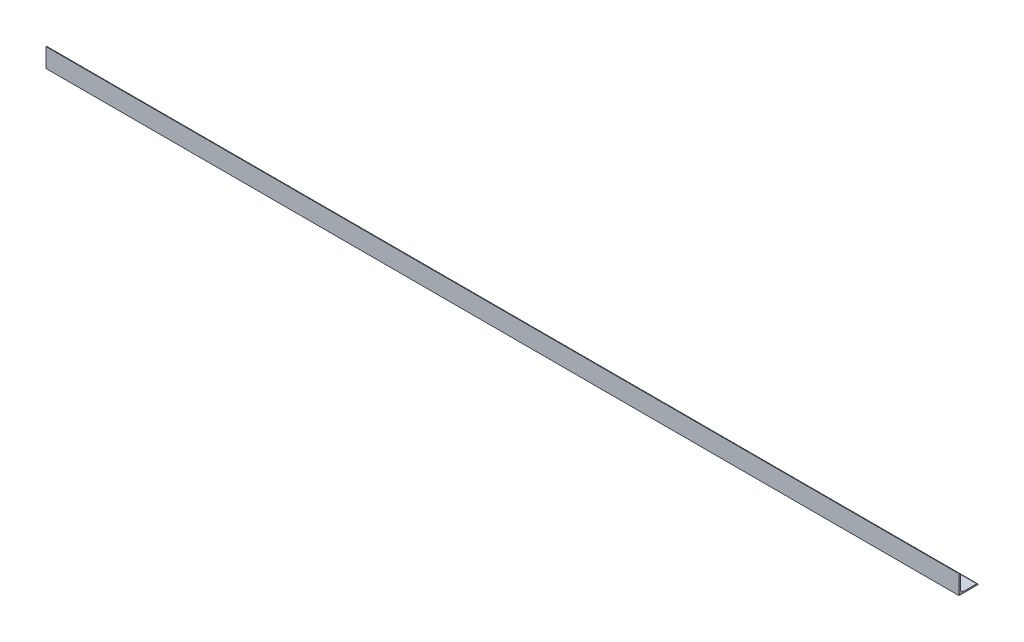
from build123d import *

# Parameters (mm, degrees)
L_ANGLE_EQUAL_40X40X3_2_DEPTH = 1920


with BuildPart() as part:
    # Sketch13 → L angle (equal) 40X40X3(2) (new body)
    with BuildSketch(Plane(origin=(0, 0, 0), x_dir=(0, 0, -1), z_dir=(1, 0, 0))):
        with BuildLine():
            Line((0, 40), (0, 0))
            Line((0, 0), (40, 0))
            ThreePointArc((40, 0), (39.121320344, 2.121320344), (37, 3))
            Line((37, 3), (9, 3))
            ThreePointArc((9, 3), (4.757359313, 4.757359313), (3, 9))
            Line((3, 9), (3, 37))
            ThreePointArc((3, 37), (2.121320344, 39.121320344), (0, 40))
        make_face()
    extrude(amount=L_ANGLE_EQUAL_40X40X3_2_DEPTH)


solid = part.part
